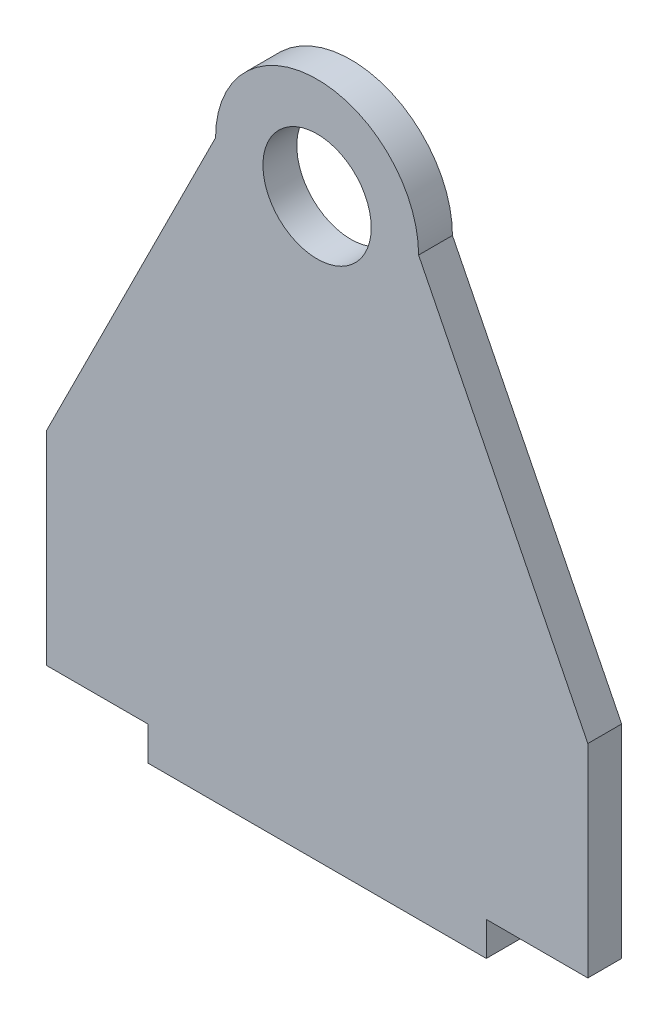
from build123d import *

# Parameters (mm, degrees)
SKETCH1_R           = 8
BOSS_EXTRUDE1_DEPTH = 5


with BuildPart() as part:
    # Sketch1 → Boss-Extrude1 (new body)
    with BuildSketch(Plane.XY):
        with BuildLine():
            Line((-40, -80), (-25, -80))
            Line((-25, -80), (-25, -85))
            Line((-25, -85), (25, -85))
            Line((25, -85), (25, -80))
            Line((25, -80), (40, -80))
            Line((40, -80), (40, -50))
            Line((40, -50), (15, 0))
            ThreePointArc((15, 0), (0, 15), (-15, 0))
            Line((-15, 0), (-40, -50))
            Line((-40, -50), (-40, -80))
        make_face()
        Circle(SKETCH1_R, mode=Mode.SUBTRACT)
    extrude(amount=BOSS_EXTRUDE1_DEPTH)


solid = part.part
